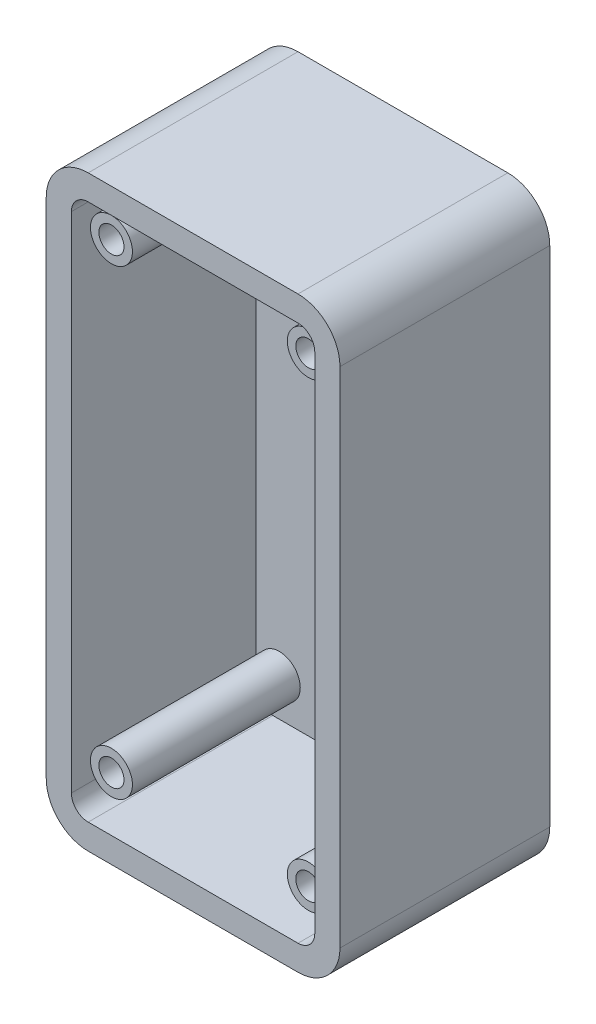
from build123d import *

# Parameters (mm, degrees)
EXTRUDE_1_DEPTH          = 25
SHELL_2_T                = -3
SKETCH_3_R               = 2.5
EXTRUDE_4_DEPTH          = 20
CUT_EXTRUDE_4_DEPTH      = 212.557459677
CUT_EXTRUDE_4_DEPTH_BACK = 212.557459677
SKETCH_4_R               = 1.5


with BuildPart() as part:
    # 草图1 → 凸台-拉伸1 (new body)
    with BuildSketch(Plane.XY):
        with BuildLine():
            Line((-193.42519685, 70), (-168.42519685, 70))
            ThreePointArc((-168.42519685, 70), (-164.889662944, 68.535533906), (-163.42519685, 65))
            Line((-163.42519685, 65), (-163.42519685, 5))
            ThreePointArc((-163.42519685, 5), (-164.889662944, 1.464466094), (-168.42519685, 0))
            Line((-168.42519685, 0), (-193.42519685, 0))
            ThreePointArc((-193.42519685, 0), (-196.960730756, 1.464466094), (-198.42519685, 5))
            Line((-198.42519685, 5), (-198.42519685, 65))
            ThreePointArc((-198.42519685, 65), (-196.960730756, 68.535533906), (-193.42519685, 70))
        make_face()
    extrude(amount=EXTRUDE_1_DEPTH)

    # 抽壳2
    shell_2_openings = [part.faces().sort_by_distance(p)[0] for p in [
        (-180.92519685, 35, 25),
    ]]
    offset(amount=SHELL_2_T, openings=shell_2_openings, kind=Kind.INTERSECTION)

    # 草图3 → 凸台-拉伸4 (add)
    with BuildSketch(Plane.XY.offset(3)):
        with Locations((-192.656739456, 62.5)):
            Circle(SKETCH_3_R)
        with Locations((-192.656739456, 7.5)):
            Circle(SKETCH_3_R)
        with Locations((-169.193654245, 62.5)):
            Circle(SKETCH_3_R)
        with Locations((-169.193654245, 7.5)):
            Circle(SKETCH_3_R)
    extrude(amount=EXTRUDE_4_DEPTH)

    # 草图4 → 切除-拉伸4 (cut, two sides: drawn at the far end of the back side and taken through both)
    with BuildSketch(Plane.XY.offset(3).offset(-CUT_EXTRUDE_4_DEPTH_BACK)):
        with Locations((-192.656739456, 62.5)):
            Circle(SKETCH_4_R)
        with Locations((-169.193654245, 62.5)):
            Circle(SKETCH_4_R)
        with Locations((-169.193654245, 7.5)):
            Circle(SKETCH_4_R)
        with Locations((-192.656739456, 7.5)):
            Circle(SKETCH_4_R)
    extrude(amount=CUT_EXTRUDE_4_DEPTH + CUT_EXTRUDE_4_DEPTH_BACK, mode=Mode.SUBTRACT)


solid = part.part
